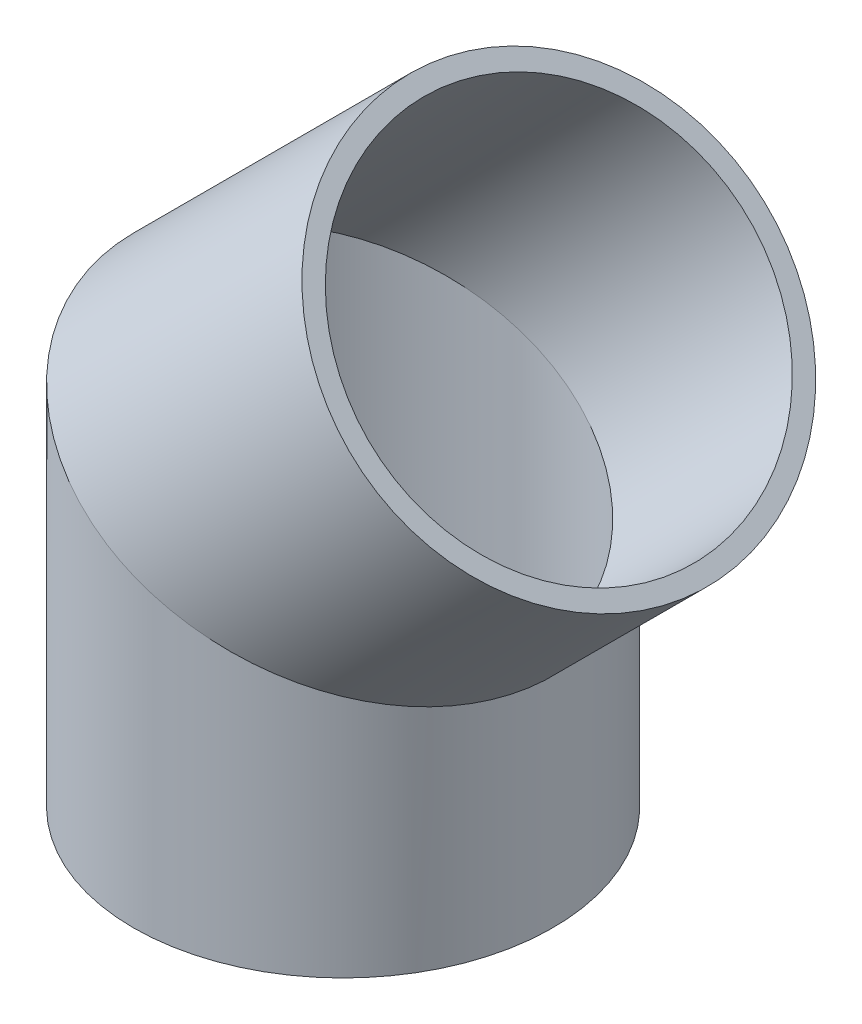
from build123d import *

# Parameters (mm, degrees)
SKETCH_1_R   = 27.5
SKETCH_1_R_2 = 25


with BuildPart() as part:
    # 扫描1: sweep along a path in 草图2
    with BuildLine(Plane.XY) as sweep_1_path:
        Line((0, 0), (0, 40))
        Line((0, 40), (28.284271247, 68.284271247))
    # 草图1 → 扫描1 (sweep)
    with BuildSketch(Plane(origin=(0, 0, 0), x_dir=(1, 0, 0), z_dir=(0, 1, 0))):
        Circle(SKETCH_1_R)
        Circle(SKETCH_1_R_2, mode=Mode.SUBTRACT)
    sweep(path=sweep_1_path.line, transition=Transition.RIGHT)


solid = part.part
